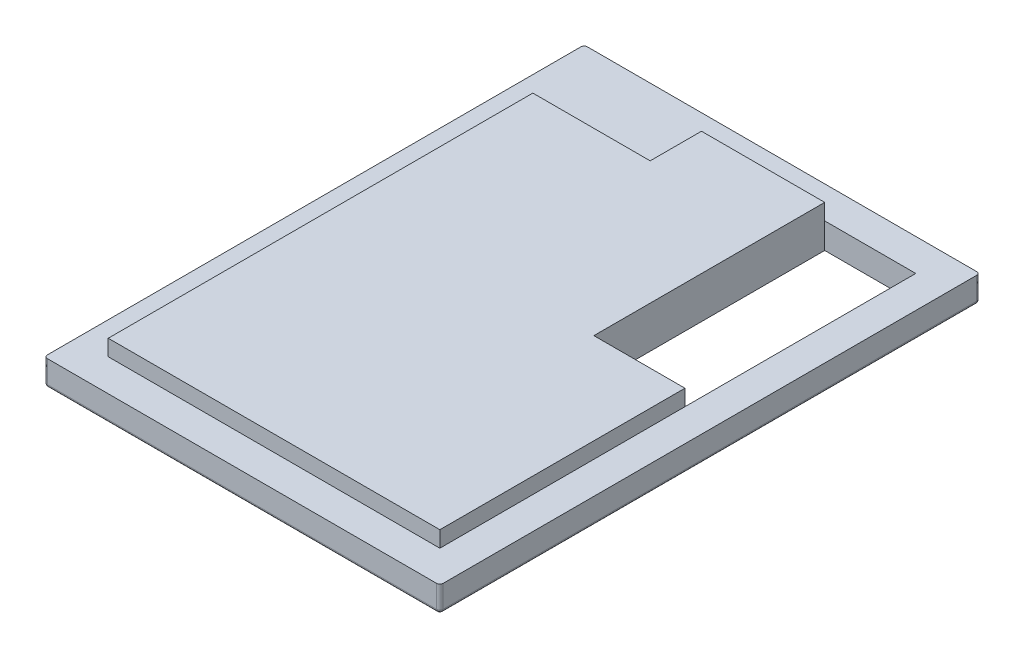
from build123d import *

# Parameters (mm, degrees)
SKETCH1_W           = 30.86
SKETCH1_H           = 42.11
BOSS_EXTRUDE1_DEPTH = 3.25
SKETCH2_OUTSIDE_W   = 43.322
SKETCH2_OUTSIDE_H   = 54.572
SKETCH2_OUTSIDE_W_2 = 25.86
SKETCH2_OUTSIDE_H_2 = 37.11
CUT_EXTRUDE1_DEPTH  = 1.25
FILLET1_R           = 0.25
SKETCH4_W           = 7.1
SKETCH4_H           = 18
CUT_EXTRUDE3_DEPTH  = 27.305140657
SKETCH5_W           = 9.15
SKETCH5_H           = 4
CUT_EXTRUDE4_DEPTH  = 1.25


with BuildPart() as part:
    # Sketch1 → Boss-Extrude1 (new body)
    with BuildSketch(Plane(origin=(0, 0, 0), x_dir=(1, 0, 0), z_dir=(0, 1, 0))):
        Rectangle(SKETCH1_W, SKETCH1_H)
    extrude(amount=BOSS_EXTRUDE1_DEPTH)

    # Sketch2 outside → Cut-Extrude1 (cut)
    with BuildSketch(Plane(origin=(0, 3.25, 0), x_dir=(1, 0, 0), z_dir=(0, 1, 0))):
        Rectangle(SKETCH2_OUTSIDE_W, SKETCH2_OUTSIDE_H)
        Rectangle(SKETCH2_OUTSIDE_W_2, SKETCH2_OUTSIDE_H_2, mode=Mode.SUBTRACT)
    extrude(amount=-CUT_EXTRUDE1_DEPTH, mode=Mode.SUBTRACT)

    # Fillet1
    fillet1_edges = [part.edges().sort_by_distance(p)[0] for p in [
        (15.43, 1, 21.055),
        (-15.43, 1, 21.055),
        (-15.43, 1, -21.055),
        (15.43, 1, -21.055),
        (0, 0, 21.055),
        (-15.43, 0, 0),
        (0, 0, -21.055),
        (15.43, 0, 0),
    ]]
    fillet(fillet1_edges, radius=FILLET1_R)

    # Sketch4 → Cut-Extrude3 (cut, through all)
    with BuildSketch(Plane(origin=(0, 0, 0), x_dir=(-1, 0, 0), z_dir=(0, -1, 0))):
        with Locations((-9.38, 9.555)):
            Rectangle(SKETCH4_W, SKETCH4_H)
    extrude(amount=-CUT_EXTRUDE3_DEPTH, mode=Mode.SUBTRACT)

    # Sketch5 → Cut-Extrude4 (cut)
    with BuildSketch(Plane(origin=(0, 3.25, 0), x_dir=(1, 0, 0), z_dir=(0, 1, 0))):
        with Locations((-8.355, 16.555)):
            Rectangle(SKETCH5_W, SKETCH5_H)
    extrude(amount=-CUT_EXTRUDE4_DEPTH, mode=Mode.SUBTRACT)


solid = part.part
